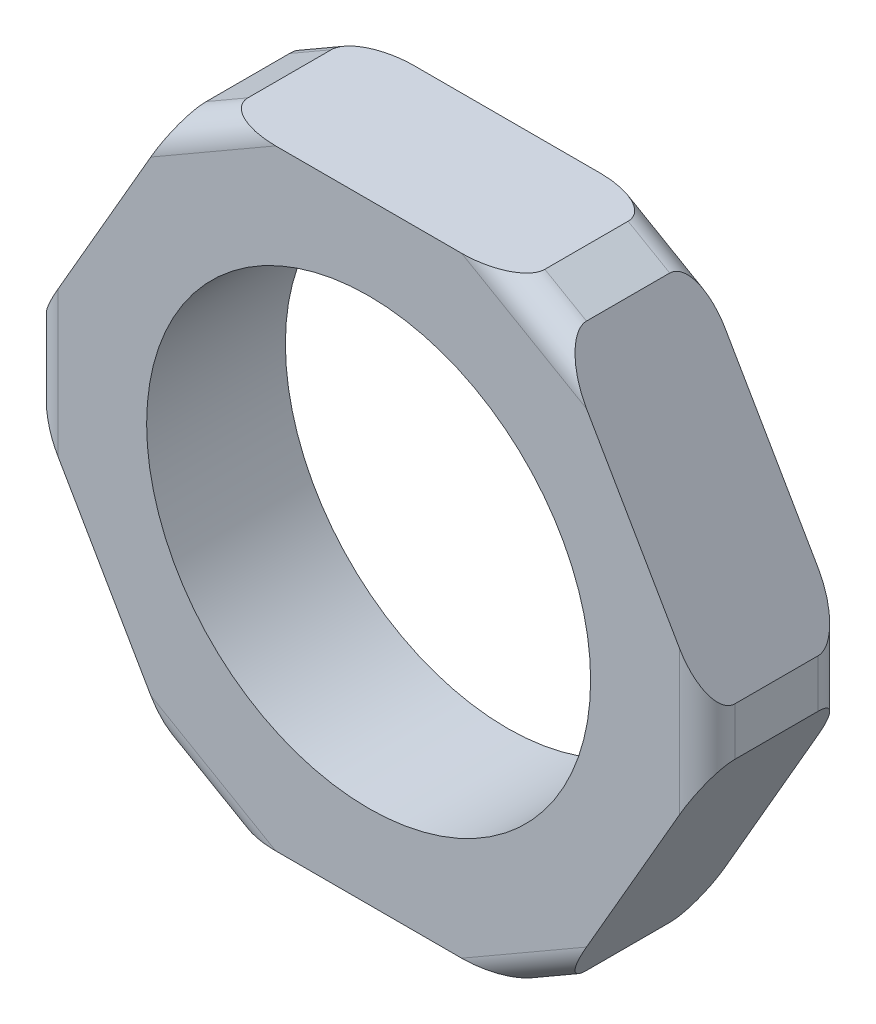
from build123d import *

# Parameters (mm, degrees)
SKETCH1_R            = 8
BOSS_EXTRUDE1_DEPTH  = 2.5
CHAMFER1_SIZE        = 1
CHAMFER1_EDGE_2_SIZE = 1
CHAMFER1_EDGE_3_SIZE = 1
CHAMFER1_EDGE_4_SIZE = 1
CHAMFER1_EDGE_5_SIZE = 1
CHAMFER1_EDGE_6_SIZE = 1
FILLET1_R            = 1


with BuildPart() as part:
    # Sketch1 → Boss-Extrude1 (new, symmetric)
    with BuildSketch(Plane.XY):
        Polygon((12.701705922, 0), (6.350852961, 11), (-6.350852961, 11), (-12.701705922, 0), (-6.350852961, -11), (6.350852961, -11), align=None)
        Circle(SKETCH1_R, mode=Mode.SUBTRACT)
    extrude(amount=BOSS_EXTRUDE1_DEPTH, both=True)

    # Chamfer1
    chamfer1_edges = [part.edges().sort_by_distance(p)[0] for p in [
        (6.350852961, -11, 0),
    ]]
    chamfer(chamfer1_edges, length=CHAMFER1_SIZE)

    # Chamfer1 edge 2
    chamfer1_edge_2_edges = [part.edges().sort_by_distance(p)[0] for p in [
        (-6.350852961, -11, 0),
    ]]
    chamfer(chamfer1_edge_2_edges, length=CHAMFER1_EDGE_2_SIZE)

    # Chamfer1 edge 3
    chamfer1_edge_3_edges = [part.edges().sort_by_distance(p)[0] for p in [
        (-12.701705922, 0, 0),
    ]]
    chamfer(chamfer1_edge_3_edges, length=CHAMFER1_EDGE_3_SIZE)

    # Chamfer1 edge 4
    chamfer1_edge_4_edges = [part.edges().sort_by_distance(p)[0] for p in [
        (-6.350852961, 11, 0),
    ]]
    chamfer(chamfer1_edge_4_edges, length=CHAMFER1_EDGE_4_SIZE)

    # Chamfer1 edge 5
    chamfer1_edge_5_edges = [part.edges().sort_by_distance(p)[0] for p in [
        (6.350852961, 11, 0),
    ]]
    chamfer(chamfer1_edge_5_edges, length=CHAMFER1_EDGE_5_SIZE)

    # Chamfer1 edge 6
    chamfer1_edge_6_edges = [part.edges().sort_by_distance(p)[0] for p in [
        (12.701705922, 0, 0),
    ]]
    chamfer(chamfer1_edge_6_edges, length=CHAMFER1_EDGE_6_SIZE)

    # Fillet1
    fillet1_edges = [part.edges().sort_by_distance(p)[0] for p in [
        (6.100852961, 10.566987298, -2.5),
        (12.201705922, 0, -2.5),
        (6.100852961, -10.566987298, -2.5),
        (-6.100852961, -10.566987298, -2.5),
        (-12.201705922, 0, -2.5),
        (-6.100852961, 10.566987298, -2.5),
        (6.100852961, 10.566987298, 2.5),
        (12.201705922, 0, 2.5),
        (6.100852961, -10.566987298, 2.5),
        (-6.100852961, -10.566987298, 2.5),
        (-12.201705922, 0, 2.5),
        (-6.100852961, 10.566987298, 2.5),
    ]]
    fillet(fillet1_edges, radius=FILLET1_R)


solid = part.part
